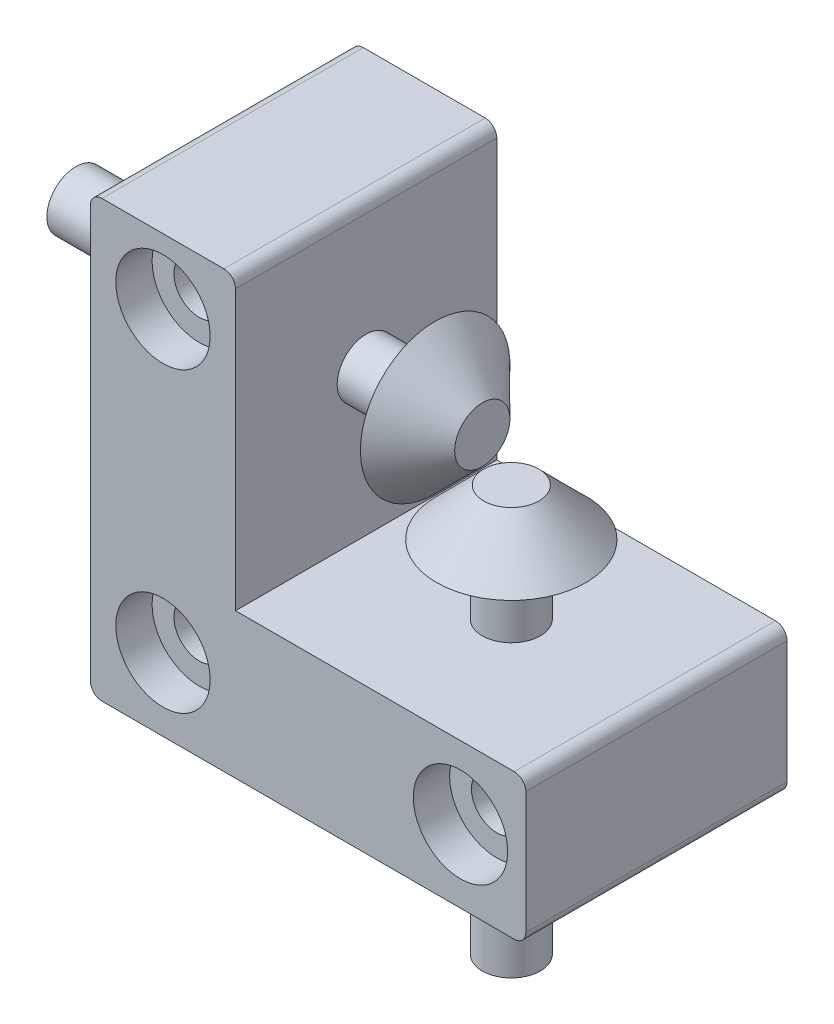
from build123d import *

# Parameters (mm, degrees)
BOSS_EXTRUDE2_DEPTH = 18
SKETCH2_R           = 1.75
CUT_EXTRUDE1_DEPTH  = 18
SKETCH3_R           = 3.25
CUT_EXTRUDE2_DEPTH  = 2.5
FILLET1_R           = 0.8
SKETCH4_R           = 2
BOSS_EXTRUDE3_DEPTH = 10


with BuildPart() as part:
    # Sketch1 → Boss-Extrude2 (new body)
    with BuildSketch(Plane.XY):
        Polygon((0, 0), (0, 30), (10, 30), (10, 10), (30, 10), (30, 0), align=None)
    extrude(amount=BOSS_EXTRUDE2_DEPTH)

    # Sketch2 → Cut-Extrude1 (cut)
    with BuildSketch(Plane(origin=(0, 0, 0), x_dir=(-1, 0, 0), z_dir=(0, 0, -1))):
        with Locations((-25.5, 5)):
            Circle(SKETCH2_R)
        with Locations((-5, 5)):
            Circle(SKETCH2_R)
        with Locations((-5, 25.5)):
            Circle(SKETCH2_R)
    extrude(amount=-CUT_EXTRUDE1_DEPTH, mode=Mode.SUBTRACT)

    # Sketch3 → Cut-Extrude2 (cut)
    with BuildSketch(Plane(origin=(0, 0, 0), x_dir=(-1, 0, 0), z_dir=(0, 0, -1))):
        with Locations((-25.5, 5)):
            Circle(SKETCH3_R)
        with Locations((-5, 5)):
            Circle(SKETCH3_R)
        with Locations((-5, 25.5)):
            Circle(SKETCH3_R)
    cut_extrude2 = extrude(amount=-CUT_EXTRUDE2_DEPTH, mode=Mode.SUBTRACT)

    # Mirror1: Cut-Extrude2 across plane
    add(cut_extrude2.mirror(Plane.XY.offset(9)), mode=Mode.SUBTRACT)

    # Fillet1
    fillet1_edges = [part.edges().sort_by_distance(p)[0] for p in [
        (10, 30, 9),
        (0, 30, 9),
        (0, 0, 9),
        (30, 0, 9),
        (30, 10, 9),
    ]]
    fillet(fillet1_edges, radius=FILLET1_R)

    # Sketch4 → Boss-Extrude3 (add)
    with BuildSketch(Plane.XZ):
        with Locations(Location((20, 9, 0), (0, 0, 270))):
            Circle(SKETCH4_R)
    boss_extrude3 = extrude(amount=BOSS_EXTRUDE3_DEPTH)

    # Mirror2: Boss-Extrude3 across plane
    add(boss_extrude3.mirror(Plane(origin=(0, 0, 0), x_dir=(0, 0, 1), z_dir=(0.7071067811865438, -0.7071067811865512, 0))))

    # Sketch5 → Revolve4 (revolve)
    with BuildSketch(Plane.XY.offset(9), mode=Mode.PRIVATE) as revolve4_sk:
        Polygon((18, 10), (18, 14.752860349), (14.85, 14.752860349), (18.097139651, 18), (20, 18), (20, 10), align=None)
    revolve4 = revolve(revolve4_sk.sketch.rotate(Axis((20, 23.873341049, 9), (0, -1, 0)), 270), axis=Axis((20, 23.873341049, 9), (0, -1, 0)))

    # Mirror7: Revolve4 across plane
    add(revolve4.mirror(Plane(origin=(0, 0, 0), x_dir=(0, 0, 1), z_dir=(0.7071067811865438, -0.7071067811865512, 0))))


solid = part.part
